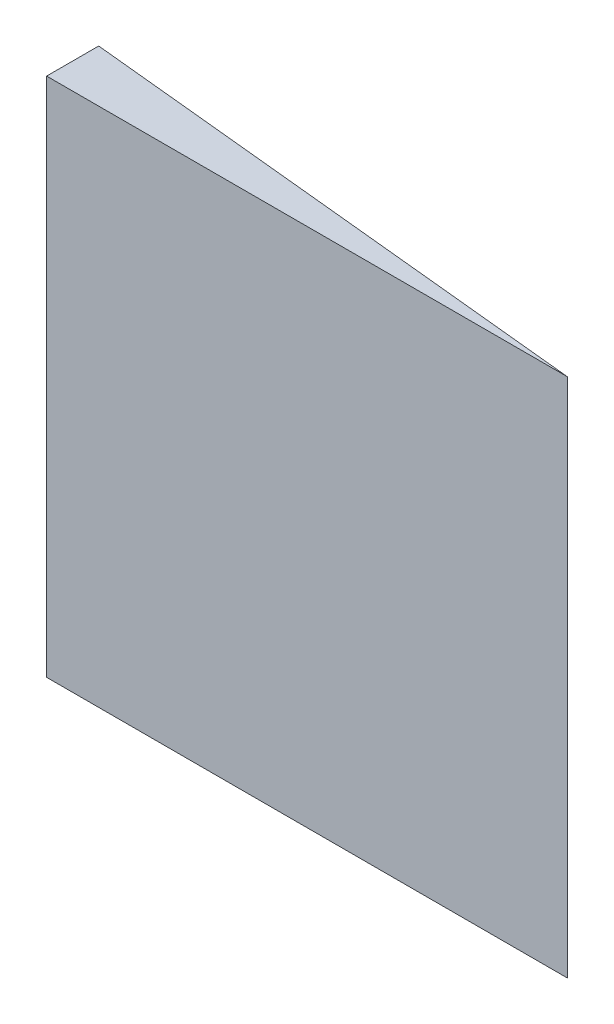
from build123d import *

# Parameters (mm, degrees)
EXTRUDE_2_DEPTH = 1000


with BuildPart() as part:
    # 草图2 → 凸台-拉伸2 (new body)
    with BuildSketch(Plane(origin=(0, 0, 0), x_dir=(1, 0, 0), z_dir=(0, 1, 0))):
        Polygon((1000, 0), (0, 100), (0, 0), align=None)
    extrude(amount=EXTRUDE_2_DEPTH)


solid = part.part
